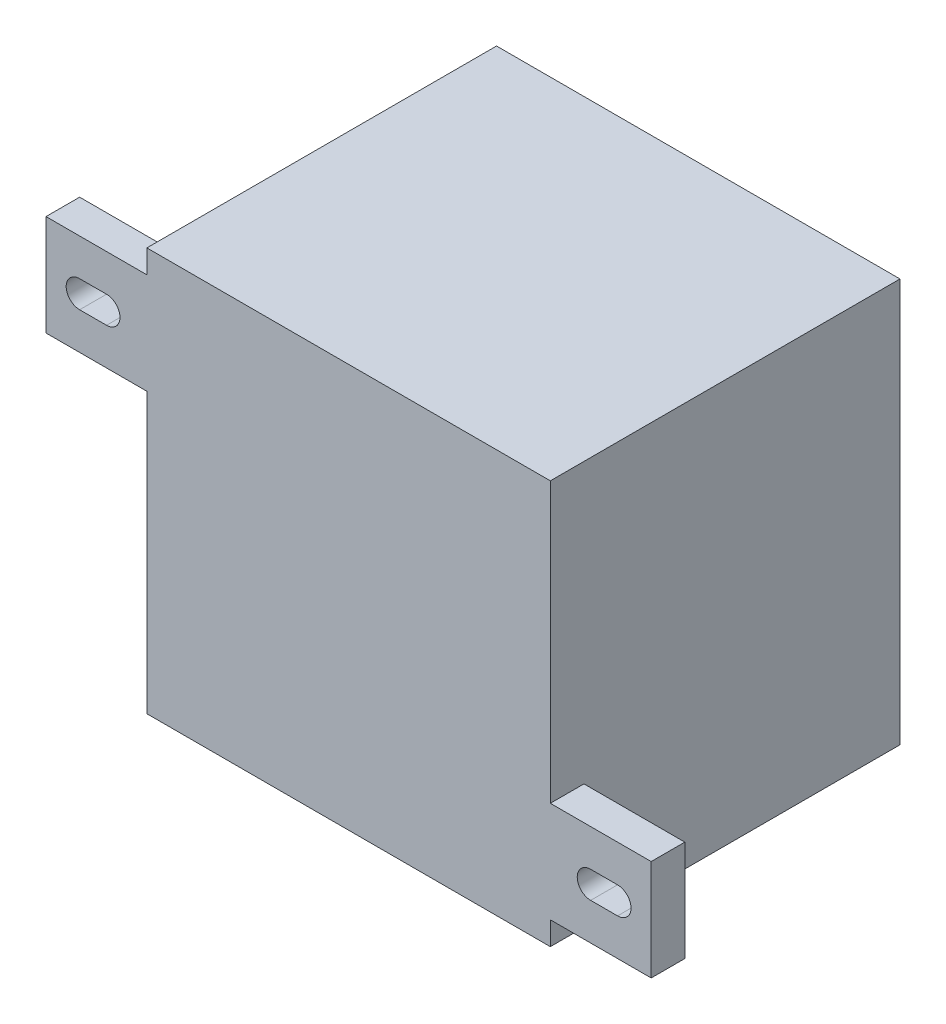
from build123d import *

# Parameters (mm, degrees)
SKETCH_1_W      = 60
SKETCH_1_H      = 60
EXTRUDE_1_DEPTH = 52
SKETCH_2_W      = 15
SKETCH_2_H      = 15
EXTRUDE_2_DEPTH = 5


with BuildPart() as part:
    # 草图1 → 凸台-拉伸1 (new body)
    with BuildSketch(Plane.XY):
        Rectangle(SKETCH_1_W, SKETCH_1_H)
    extrude(amount=EXTRUDE_1_DEPTH)

    # 草图2 → 凸台-拉伸2 (add)
    # profile 1 of 2: a face of its own
    with BuildSketch(Plane.XY.offset(52)):
        with Locations((-37.5, 19.032866311)):
            Rectangle(SKETCH_2_W, SKETCH_2_H)
        with BuildLine():
            Line((-40, 21.032866311), (-36, 21.032866311))
            ThreePointArc((-36, 21.032866311), (-34, 19.032866311), (-36, 17.032866311))
            Line((-36, 17.032866311), (-40, 17.032866311))
            ThreePointArc((-40, 17.032866311), (-42, 19.032866311), (-40, 21.032866311))
        make_face(mode=Mode.SUBTRACT)
    # profile 2 of 2: a face of its own
    with BuildSketch(Plane.XY.offset(52)):
        with Locations((37.5, -19.032866311)):
            Rectangle(SKETCH_2_W, SKETCH_2_H)
        with BuildLine():
            Line((40, -21.032866311), (36, -21.032866311))
            ThreePointArc((36, -21.032866311), (34, -19.032866311), (36, -17.032866311))
            Line((36, -17.032866311), (40, -17.032866311))
            ThreePointArc((40, -17.032866311), (42, -19.032866311), (40, -21.032866311))
        make_face(mode=Mode.SUBTRACT)
    extrude(amount=-EXTRUDE_2_DEPTH)


solid = part.part
